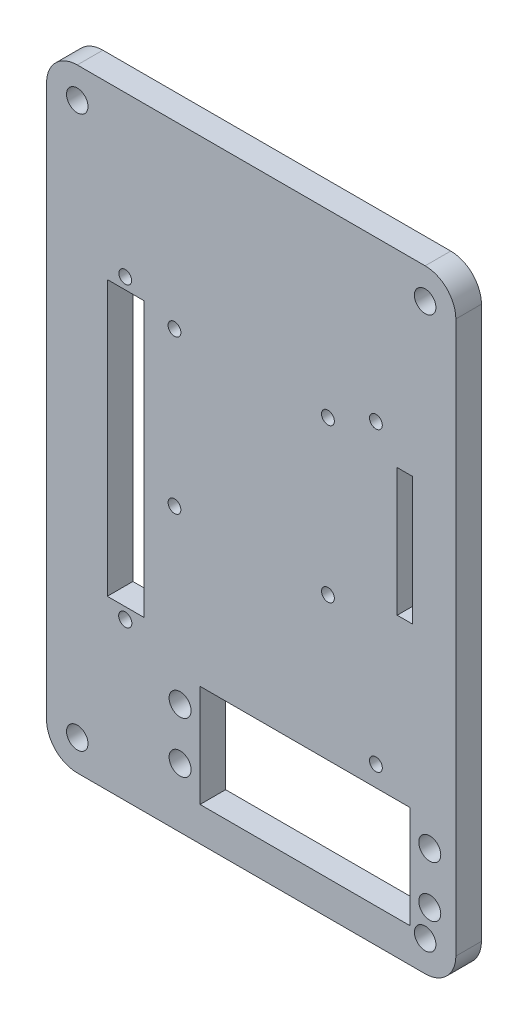
from build123d import *

# Parameters (mm, degrees)
IZIM1_W                              = 80
IZIM1_H                              = 100
Y_KSEKLIK_EKSTR_ZYON1_DEPTH          = 5
IZIM2_R                              = 1.25
IZIM2_R_2                            = 1.286520495
KES_EKSTR_ZYON1_DEPTH                = 10
M4_HELISARMAL_I_IN_Z_VANA_MATKAB_1_D = 4.2
RADYUS1_R                            = 6
RADYUS2_R                            = 6
RADYUS3_R                            = 6
RADYUS4_R                            = 6
IZIM4_W                              = 3
IZIM4_H                              = 25
IZIM4_R                              = 1.25
IZIM4_R_2                            = 1.255794896
KES_EKSTR_ZYON2_DEPTH                = 50
IZIM5_W                              = 7.124534101
IZIM5_H                              = 53.617419338
KES_EKSTR_ZYON3_DEPTH                = 50
IZIM6_R                              = 2.6
IZIM6_R_2                            = 2.15
IZIM6_R_3                            = 2.1
Y_KSEKLIK_EKSTR_ZYON2_DEPTH          = 5
IZIM7_R                              = 2.15
KES_EKSTR_ZYON4_DEPTH                = 5
KES_EKSTR_ZYON5_DEPTH                = 5


with BuildPart() as part:
    # Çizim1 → Yükseklik-Ekstrüzyon1 (new body)
    with BuildSketch(Plane.XY):
        with Locations((8.667082878, 5.369127517)):
            Rectangle(IZIM1_W, IZIM1_H)
    extrude(amount=Y_KSEKLIK_EKSTR_ZYON1_DEPTH)

    # Çizim2 → Kes-Ekstrüzyon1 (cut)
    with BuildSketch(Plane(origin=(0, 0, 0), x_dir=(-1, 0, 0), z_dir=(0, 0, -1))):
        with Locations((15.957451223, 24.185733017)):
            Circle(IZIM2_R)
        with Locations((-33.042548777, 24.185733017)):
            Circle(IZIM2_R)
        with Locations((-33.042548777, -33.814266983)):
            Circle(IZIM2_R)
        with Locations((15.957451223, -33.814266983)):
            Circle(IZIM2_R_2)
    extrude(amount=-KES_EKSTR_ZYON1_DEPTH, mode=Mode.SUBTRACT)

    # M4 Helisarmal için Zıvana matkabı1 (through all)
    with Locations(Plane(origin=(-25.332917122, -38.630872483, 0), x_dir=(-1, 0, 0), z_dir=(0, 0, -1))):
        with Locations((0, 0), (-68, 0), (0, 88), (-68, 88)):
            Hole(M4_HELISARMAL_I_IN_Z_VANA_MATKAB_1_D / 2)

    # Radyus1
    radyus1_edges = [part.edges().sort_by_distance(p)[0] for p in [
        (-31.332917122, 55.369127517, 2.5),
    ]]
    fillet(radyus1_edges, radius=RADYUS1_R)

    # Radyus2
    radyus2_edges = [part.edges().sort_by_distance(p)[0] for p in [
        (-31.332917122, -44.630872483, 2.5),
    ]]
    fillet(radyus2_edges, radius=RADYUS2_R)

    # Radyus3
    radyus3_edges = [part.edges().sort_by_distance(p)[0] for p in [
        (48.667082878, -44.630872483, 2.5),
    ]]
    fillet(radyus3_edges, radius=RADYUS3_R)

    # Radyus4
    radyus4_edges = [part.edges().sort_by_distance(p)[0] for p in [
        (48.667082878, 55.369127517, 2.5),
    ]]
    fillet(radyus4_edges, radius=RADYUS4_R)

    # Çizim4 → Kes-Ekstrüzyon2 (cut)
    with BuildSketch(Plane.XY.offset(5)):
        with Locations((38.703217921, 5.985733017)):
            Rectangle(IZIM4_W, IZIM4_H)
        with Locations((23.667082878, -9.814266983)):
            Circle(IZIM4_R)
        with Locations((23.667082878, 20.185733017)):
            Circle(IZIM4_R_2)
        with Locations((-6.332917122, 20.185733017)):
            Circle(IZIM4_R)
        with Locations((-6.332917122, -9.814266983)):
            Circle(IZIM4_R)
    extrude(amount=-KES_EKSTR_ZYON2_DEPTH, mode=Mode.SUBTRACT)

    # Çizim5 → Kes-Ekstrüzyon3 (cut)
    with BuildSketch(Plane(origin=(0, 0, 0), x_dir=(-1, 0, 0), z_dir=(0, 0, -1))):
        with Locations((15.895184173, -4.826044253)):
            Rectangle(IZIM5_W, IZIM5_H)
    extrude(amount=-KES_EKSTR_ZYON3_DEPTH, mode=Mode.SUBTRACT)

    # Çizim6 → Yükseklik-Ekstrüzyon2 (add)
    # profile 1 of 3: a face of its own
    with BuildSketch(Plane.XY.offset(5)):
        with Locations((-25.332917122, -38.630872483)):
            Circle(IZIM6_R)
    # profile 2 of 3: a face of its own
    with BuildSketch(Plane.XY.offset(5)):
        with Locations((42.667082878, -38.630872483)):
            Circle(IZIM6_R)
    # profile 3 of 3: a face of its own
    with BuildSketch(Plane.XY.offset(5)):
        with BuildLine():
            Line((-31.332917122, -38.630872483), (48.667082878, -38.630872483))
            Line((48.667082878, -38.630872483), (48.667082878, -58.482911504))
            ThreePointArc((48.667082878, -58.482911504), (46.909723565, -62.725552191), (42.667082878, -64.482911504))
            Line((42.667082878, -64.482911504), (-25.332917122, -64.482911504))
            ThreePointArc((-25.332917122, -64.482911504), (-29.575557809, -62.725552191), (-31.332917122, -58.482911504))
            Line((-31.332917122, -58.482911504), (-31.332917122, -38.630872483))
        make_face()
        with Locations((-5.232917122, -52.814266983)):
            Circle(IZIM6_R_2, mode=Mode.SUBTRACT)
        with Locations((-5.232917122, -42.814266983)):
            Circle(IZIM6_R_2, mode=Mode.SUBTRACT)
        with Locations((43.567082878, -42.814266983)):
            Circle(IZIM6_R_2, mode=Mode.SUBTRACT)
        with Locations((43.567082878, -52.814266983)):
            Circle(IZIM6_R_2, mode=Mode.SUBTRACT)
        with Locations((-25.332917122, -58.482911504)):
            Circle(IZIM6_R_3, mode=Mode.SUBTRACT)
        with Locations((42.667082878, -58.482911504)):
            Circle(IZIM6_R_3, mode=Mode.SUBTRACT)
    extrude(amount=-Y_KSEKLIK_EKSTR_ZYON2_DEPTH)

    # Çizim7 → Kes-Ekstrüzyon4 (cut)
    with BuildSketch(Plane.XY.offset(5)):
        with Locations((43.567082878, -42.814266983)):
            Circle(IZIM7_R)
        with Locations((-5.232917122, -42.814266983)):
            Circle(IZIM7_R)
    extrude(amount=-KES_EKSTR_ZYON4_DEPTH, mode=Mode.SUBTRACT)

    # Çizim8 → Kes-Ekstrüzyon5 (cut)
    with BuildSketch(Plane.XY.offset(5)):
        Polygon((-1.332917122, -37.814266983), (-1.332917122, -38.614266983), (-1.332917122, -57.814266983), (39.667082878, -57.814266983), (39.667082878, -37.814266983), align=None)
    extrude(amount=-KES_EKSTR_ZYON5_DEPTH, mode=Mode.SUBTRACT)


solid = part.part
